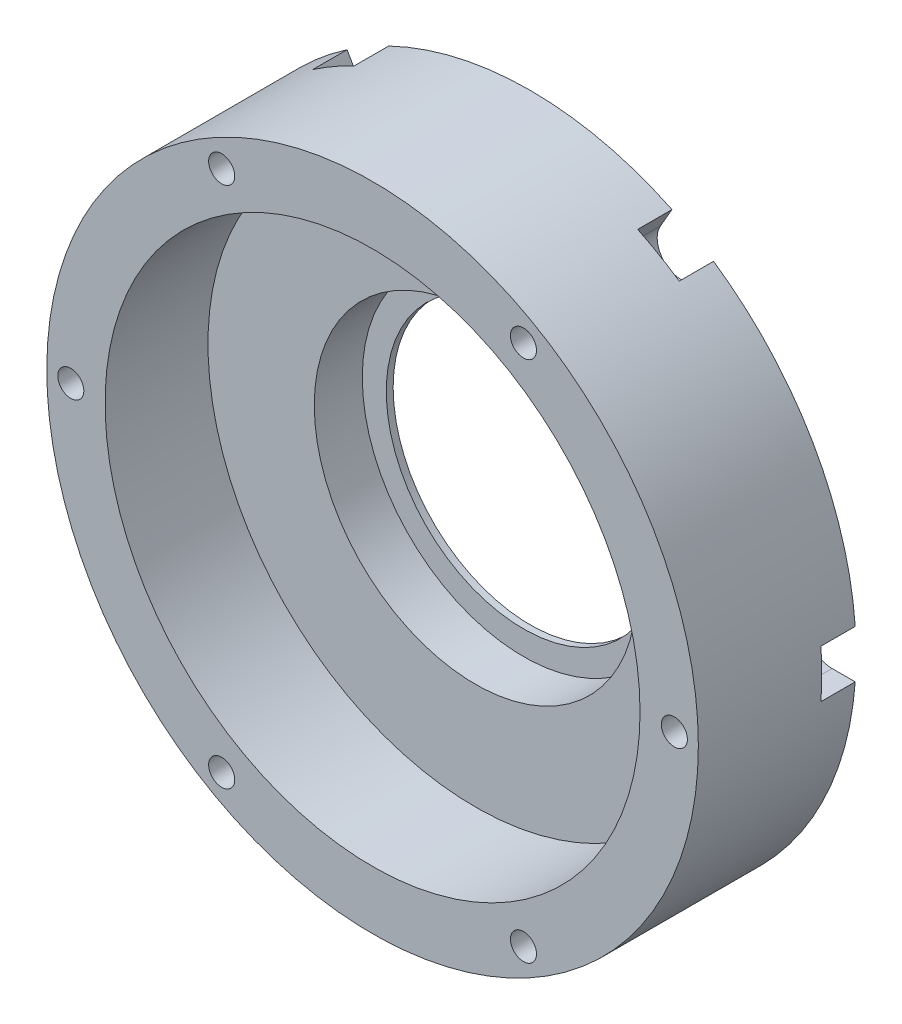
from build123d import *

# Parameters (mm, degrees)
SKETCH1_R           = 47.5
SKETCH1_R_2         = 39
BOSS_EXTRUDE1_DEPTH = 15
BOSS_EXTRUDE2_START = 8
SKETCH4_R           = 47.5
SKETCH4_R_2         = 20
BOSS_EXTRUDE2_DEPTH = 8
SKETCH5_R           = 23.5
CUT_EXTRUDE3_DEPTH  = 7
SKETCH6_R           = 1.9
CUT_EXTRUDE4_DEPTH  = 72.003521039
CUT_EXTRUDE5_DEPTH  = 5


with BuildPart() as part:
    # Sketch1 → Boss-Extrude1 (new body)
    with BuildSketch(Plane.XY):
        Circle(SKETCH1_R)
        Circle(SKETCH1_R_2, mode=Mode.SUBTRACT)
    extrude(amount=BOSS_EXTRUDE1_DEPTH)

    # Sketch4 → Boss-Extrude2 (add)
    with BuildSketch(Plane(origin=(0, 0, 0), x_dir=(-1, 0, 0), z_dir=(0, 0, -1)).offset(BOSS_EXTRUDE2_START)):
        Circle(SKETCH4_R)
        Circle(SKETCH4_R_2, mode=Mode.SUBTRACT)
    extrude(amount=-BOSS_EXTRUDE2_DEPTH)

    # Sketch5 → Cut-Extrude3 (cut)
    with BuildSketch(Plane.XY):
        Circle(SKETCH5_R)
    extrude(amount=-CUT_EXTRUDE3_DEPTH, mode=Mode.SUBTRACT)

    # Sketch6 → Cut-Extrude4 (cut, through all)
    with BuildSketch(Plane.XY.offset(15)):
        with Locations((44, 0)):
            Circle(SKETCH6_R)
        with Locations((22, -38.105117767)):
            Circle(SKETCH6_R)
        with Locations((-22, -38.105117767)):
            Circle(SKETCH6_R)
        with Locations((-44, 0)):
            Circle(SKETCH6_R)
        with Locations((-22, 38.105117767)):
            Circle(SKETCH6_R)
        with Locations((22, 38.105117767)):
            Circle(SKETCH6_R)
    extrude(amount=-CUT_EXTRUDE4_DEPTH, mode=Mode.SUBTRACT)

    # Sketch7 → Cut-Extrude5 (cut)
    with BuildSketch(Plane(origin=(0, 0, -8), x_dir=(-1, 0, 0), z_dir=(0, 0, -1))):
        with BuildLine():
            Line((44, 3.5), (47.370877129, 3.5))
            ThreePointArc((47.370877129, 3.5), (47.5, 0), (47.370877129, -3.5))
            Line((47.370877129, -3.5), (44, -3.5))
            ThreePointArc((44, -3.5), (40.5, 0), (44, 3.5))
        make_face()
        with BuildLine():
            Line((25.031088913, -36.355117767), (26.716527478, -39.274382994))
            ThreePointArc((26.716527478, -39.274382994), (23.75, -41.13620668), (20.654349651, -42.774382994))
            Line((20.654349651, -42.774382994), (18.968911087, -39.855117767))
            ThreePointArc((18.968911087, -39.855117767), (20.25, -35.074028853), (25.031088913, -36.355117767))
        make_face()
        with BuildLine():
            Line((-18.968911087, -39.855117767), (-20.654349651, -42.774382994))
            ThreePointArc((-20.654349651, -42.774382994), (-23.75, -41.13620668), (-26.716527478, -39.274382994))
            Line((-26.716527478, -39.274382994), (-25.031088913, -36.355117767))
            ThreePointArc((-25.031088913, -36.355117767), (-20.25, -35.074028853), (-18.968911087, -39.855117767))
        make_face()
        with BuildLine():
            Line((-44, -3.5), (-47.370877129, -3.5))
            ThreePointArc((-47.370877129, -3.5), (-47.5, 0), (-47.370877129, 3.5))
            Line((-47.370877129, 3.5), (-44, 3.5))
            ThreePointArc((-44, 3.5), (-40.5, 0), (-44, -3.5))
        make_face()
        with BuildLine():
            Line((-25.031088913, 36.355117767), (-26.716527478, 39.274382994))
            ThreePointArc((-26.716527478, 39.274382994), (-23.75, 41.13620668), (-20.654349651, 42.774382994))
            Line((-20.654349651, 42.774382994), (-18.968911087, 39.855117767))
            ThreePointArc((-18.968911087, 39.855117767), (-20.25, 35.074028853), (-25.031088913, 36.355117767))
        make_face()
        with BuildLine():
            Line((18.968911087, 39.855117767), (20.654349651, 42.774382994))
            ThreePointArc((20.654349651, 42.774382994), (23.75, 41.13620668), (26.716527478, 39.274382994))
            Line((26.716527478, 39.274382994), (25.031088913, 36.355117767))
            ThreePointArc((25.031088913, 36.355117767), (20.25, 35.074028853), (18.968911087, 39.855117767))
        make_face()
    extrude(amount=-CUT_EXTRUDE5_DEPTH, mode=Mode.SUBTRACT)


solid = part.part
